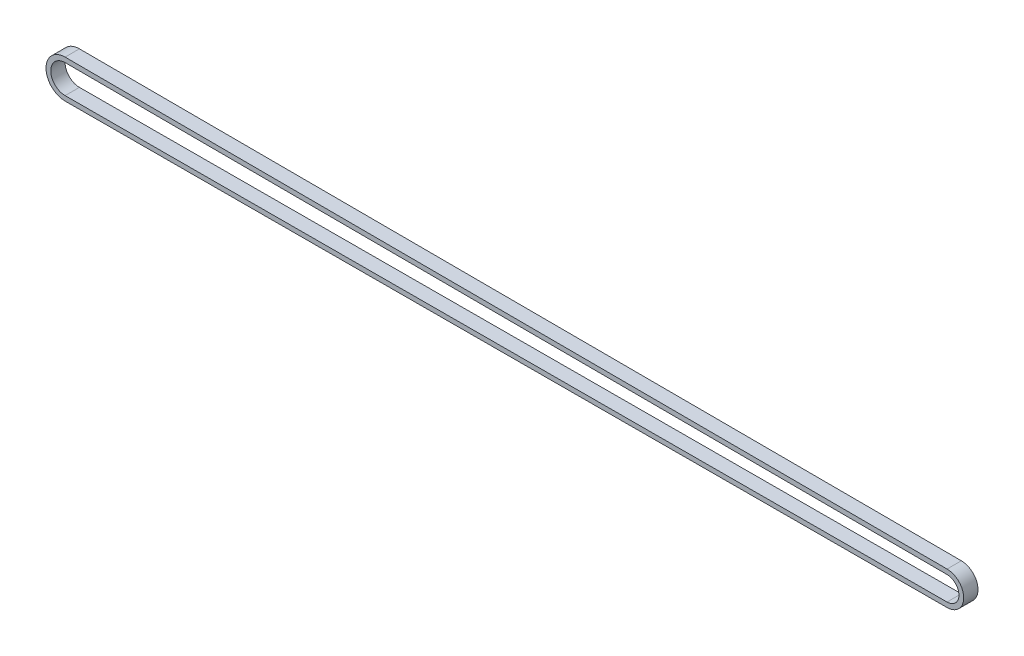
from build123d import *

# Parameters (mm, degrees)
RESSALTO_EXTRUS_O1_DEPTH = 6


with BuildPart() as part:
    # Esboço1 → Ressalto-extrusão1 (new body)
    with BuildSketch(Plane.XY):
        with BuildLine():
            Line((-369.978378378, 7.999970782), (0.018918919, 6.999974434))
            ThreePointArc((0.018918919, 6.999974434), (7, 0), (0.018918919, -6.999974434))
            Line((0.018918919, -6.999974434), (-369.978378378, -7.999970782))
            ThreePointArc((-369.978378378, -7.999970782), (-378, 0), (-369.978378378, 7.999970782))
        make_face()
        with BuildLine():
            Line((-369.983783784, 5.999978086), (0.013513514, 4.999981738))
            ThreePointArc((0.013513514, 4.999981738), (5, 0), (0.013513514, -4.999981738))
            Line((0.013513514, -4.999981738), (-369.983783784, -5.999978086))
            ThreePointArc((-369.983783784, -5.999978086), (-376, 0), (-369.983783784, 5.999978086))
        make_face(mode=Mode.SUBTRACT)
    extrude(amount=RESSALTO_EXTRUS_O1_DEPTH)


solid = part.part
